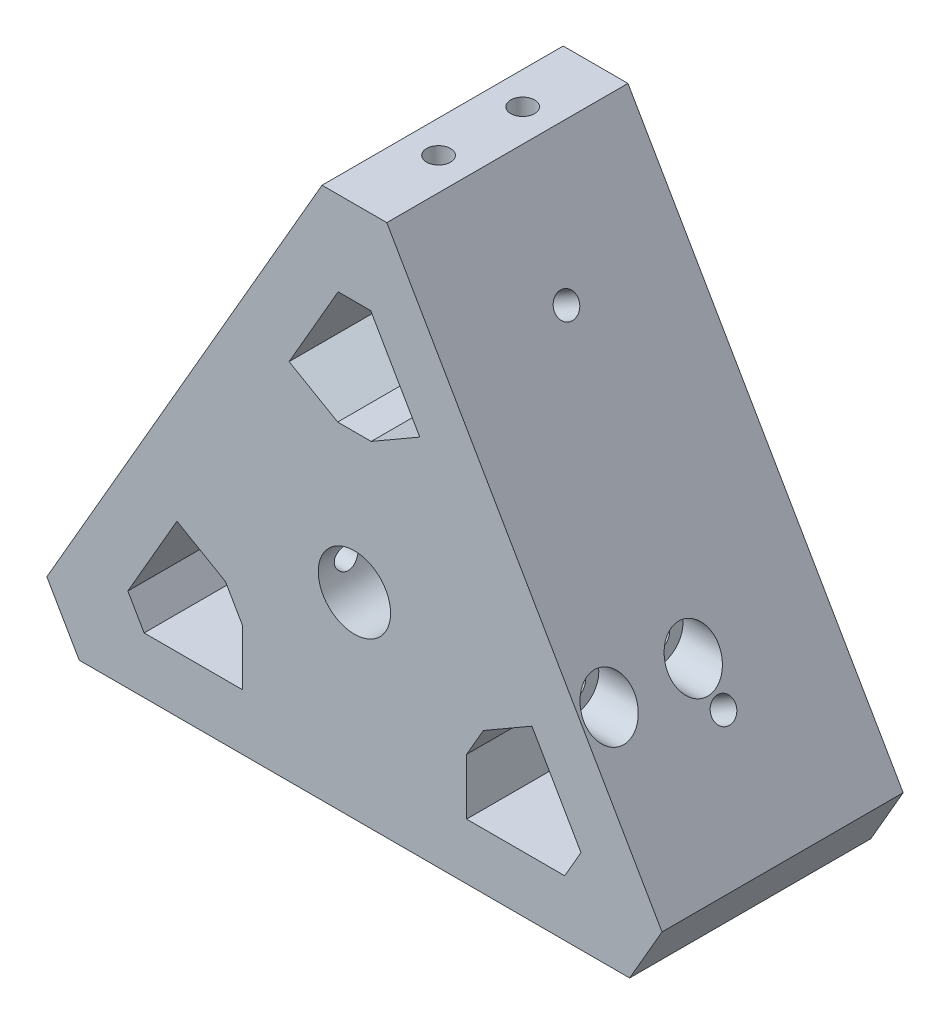
from build123d import *

# Parameters (mm, degrees)
SKETCH_1_R               = 6.45
EXTRUDE_1_DEPTH          = 43
CUT_EXTRUDE_3_DEPTH      = 92.963760979
SKETCH_3_R               = 2.125
CUT_EXTRUDE_4_DEPTH      = 15
PATTERN_CIRCULAR_1_COUNT = 3
SKETCH_4_R               = 2.125
CUT_EXTRUDE_5_DEPTH      = 118.823314048
SKETCH_6_R               = 2.15
CUT_EXTRUDE_7_DEPTH      = 128.471565491
SKETCH_7_R               = 4.5
CUT_EXTRUDE_8_DEPTH      = 15


with BuildPart() as part:
    # 草图1 → 凸台-拉伸1 (new body)
    with BuildSketch(Plane.XY):
        Polygon((5.773502692, 60), (-5.773502692, 60), (-54.848275573, -25), (-49.074772881, -35), (49.074772881, -35), (54.848275573, -25), align=None)
        Circle(SKETCH_1_R, mode=Mode.SUBTRACT)
    extrude(amount=EXTRUDE_1_DEPTH)

    # 草图2 → 切除-拉伸3 (cut, through all)
    with BuildSketch(Plane.XY.offset(43)):
        Polygon((5.759618943, 39.975952642), (0, 43.301270189), (-5.759618943, 39.975952642), (0, 30), align=None)
        Polygon((0, 43.301270189), (-2.900635095, 44.975952642), (-11.650635095, 29.820508076), (-2.990381057, 24.820508076), (0, 30), (-5.759618943, 39.975952642), align=None)
        Polygon((2.900635095, 44.975952642), (0, 43.301270189), (5.759618943, 39.975952642), (0, 30), (2.990381057, 24.820508076), (11.650635095, 29.820508076), align=None)
        Polygon((-22.990381057, -9.820508076), (-31.650635095, -4.820508076), (-40.400635095, -19.975952642), (-37.5, -21.650635095), (-37.5, -15), (-25.980762114, -15), align=None)
        Polygon((-37.5, -15), (-37.5, -21.650635095), (-31.740381057, -24.975952642), (-25.980762114, -15), align=None)
        Polygon((-31.740381057, -24.975952642), (-37.5, -21.650635095), (-37.5, -25), (-20, -25), (-20, -15), (-25.980762114, -15), align=None)
        Polygon((25.980762114, -15), (20, -15), (20, -25), (37.5, -25), (37.5, -21.650635095), (31.740381057, -24.975952642), align=None)
        Polygon((37.5, -15), (25.980762114, -15), (31.740381057, -24.975952642), (37.5, -21.650635095), align=None)
        Polygon((40.400635095, -19.975952642), (31.650635095, -4.820508076), (22.990381057, -9.820508076), (25.980762114, -15), (37.5, -15), (37.5, -21.650635095), align=None)
        Polygon((2.900635095, 44.975952642), (-2.900635095, 44.975952642), (0, 43.301270189), align=None)
        Polygon((-37.5, -21.650635095), (-40.400635095, -19.975952642), (-37.5, -25), align=None)
        Polygon((37.5, -25), (40.400635095, -19.975952642), (37.5, -21.650635095), align=None)
        Polygon((25.980762114, -15), (22.990381057, -9.820508076), (20, -15), align=None)
        Polygon((-20, -15), (-22.990381057, -9.820508076), (-25.980762114, -15), align=None)
        Polygon((0, 30), (-2.990381057, 24.820508076), (2.990381057, 24.820508076), align=None)
    extrude(amount=-CUT_EXTRUDE_3_DEPTH, mode=Mode.SUBTRACT)

    # 草图3 → 切除-拉伸4 (cut)
    with BuildSketch(Plane(origin=(-30.310889132, 17.5, 0), x_dir=(0, 0, 1), z_dir=(-0.8660254037844362, 0.5000000000000046, 0))):
        with Locations(Location((21.5, 28, 0), (0, 0, 270))):
            Circle(SKETCH_3_R)
        with Locations(Location((21.5, -28, 0), (0, 0, 90))):
            Circle(SKETCH_3_R)
    cut_extrude_4 = extrude(amount=-CUT_EXTRUDE_4_DEPTH, mode=Mode.SUBTRACT)

    # 阵列(圆周)1: 切除-拉伸4 ×3 about axis
    pattern_circular_1_axis = Axis((0, 0, 43), (0, 0, -1))
    for i in range(1, PATTERN_CIRCULAR_1_COUNT):
        add(cut_extrude_4.rotate(pattern_circular_1_axis, i * 360 / PATTERN_CIRCULAR_1_COUNT), mode=Mode.SUBTRACT)

    # 草图4 → 切除-拉伸5 (cut, through all)
    with BuildSketch(Plane.XZ.offset(35)):
        with Locations(Location((0, 13, 0), (0, 0, 270))):
            Circle(SKETCH_4_R)
        with Locations(Location((0, 28, 0), (0, 0, 270))):
            Circle(SKETCH_4_R)
    extrude(amount=-CUT_EXTRUDE_5_DEPTH, mode=Mode.SUBTRACT)

    # 草图6 → 切除-拉伸7 (cut, through all)
    with BuildSketch(Plane(origin=(49.074772881, 0, 0), x_dir=(0, 0, -1), z_dir=(-1, 0, 0))):
        with Locations(Location((-23, 0, 0), (0, 0, 270))):
            Circle(SKETCH_6_R)
        with Locations(Location((-38, 0, 0), (0, 0, 270))):
            Circle(SKETCH_6_R)
    extrude(amount=CUT_EXTRUDE_7_DEPTH, mode=Mode.SUBTRACT)

    # 草图7 → 切除-拉伸8 (cut)
    with BuildSketch(Plane(origin=(49.074772881, 0, 0), x_dir=(0, 0, -1), z_dir=(-1, 0, 0))):
        with Locations(Location((-38, 0, 0), (0, 0, 90))):
            Circle(SKETCH_7_R)
        with Locations(Location((-23, 0, 0), (0, 0, 90))):
            Circle(SKETCH_7_R)
    extrude(amount=CUT_EXTRUDE_8_DEPTH, mode=Mode.SUBTRACT)


solid = part.part
